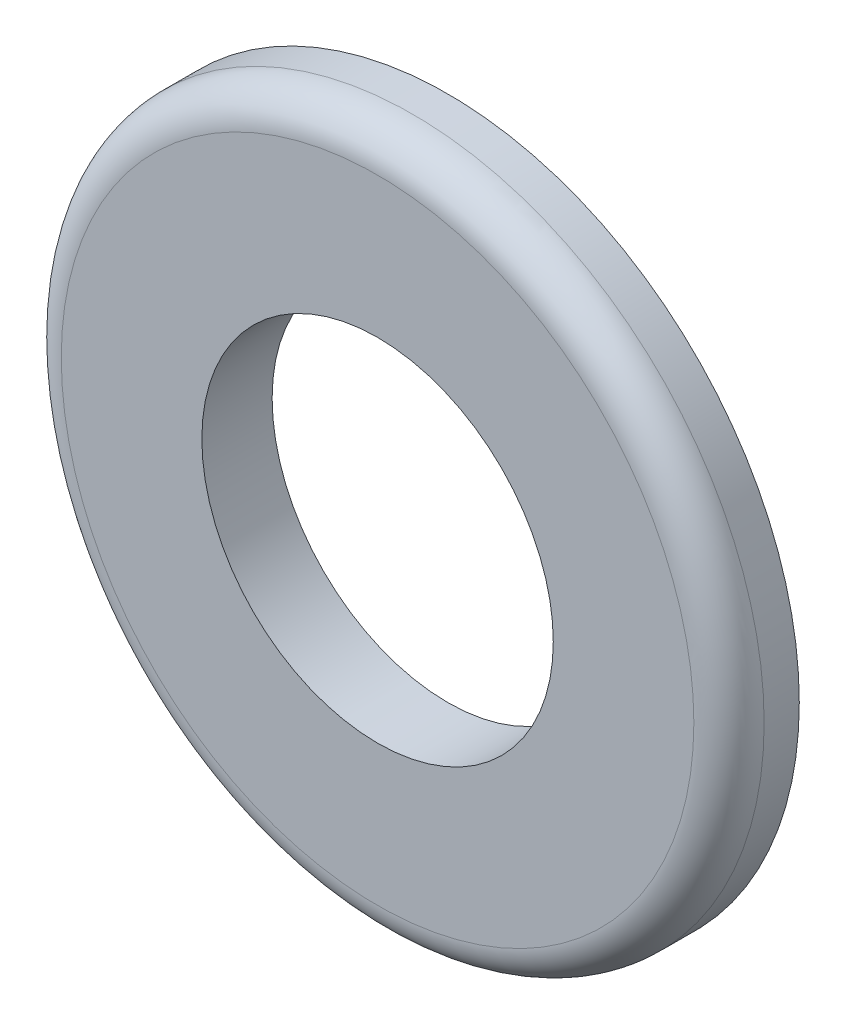
from build123d import *

# Parameters (mm, degrees)
CROQUIS1_R              = 5
CROQUIS1_R_2            = 2.5
SALIENTE_EXTRUIR1_DEPTH = 1
REDONDEO1_R             = 0.5


with BuildPart() as part:
    # Croquis1 → Saliente-Extruir1 (new body)
    with BuildSketch(Plane.XY):
        Circle(CROQUIS1_R)
        Circle(CROQUIS1_R_2, mode=Mode.SUBTRACT)
    extrude(amount=SALIENTE_EXTRUIR1_DEPTH)

    # Redondeo1
    redondeo1_edges = [part.edges().sort_by_distance(p)[0] for p in [
        (-5, 0, 1),
    ]]
    fillet(redondeo1_edges, radius=REDONDEO1_R)


solid = part.part
